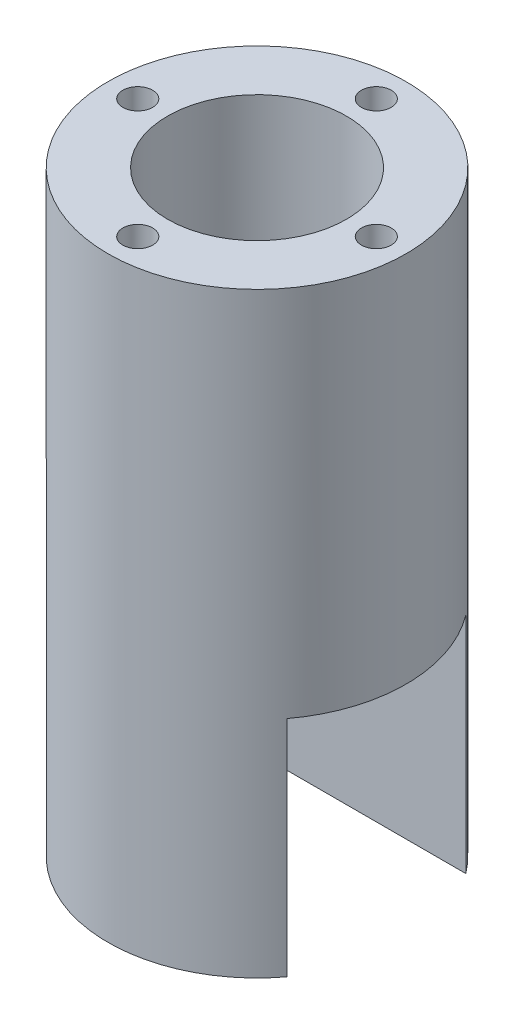
from build123d import *

# Parameters (mm, degrees)
SKETCH_1_R               = 10
SKETCH_1_R_2             = 6
EXTRUDE_1_DEPTH          = 40
SKETCH_2_R               = 1
CUT_EXTRUDE_1_DEPTH      = 2
CUT_EXTRUDE_2_DEPTH      = 43.426406871
CUT_EXTRUDE_2_DEPTH_BACK = 43.426406871
SKETCH_3_W               = 12
SKETCH_3_H               = 15


with BuildPart() as part:
    # 草图1 → 凸台-拉伸1 (new body)
    with BuildSketch(Plane(origin=(0, 0, 0), x_dir=(1, 0, 0), z_dir=(0, 1, 0))):
        with Locations(Location((0, 0, 0), (0, 0, 270))):
            Circle(SKETCH_1_R)
        with Locations(Location((0, 0, 0), (0, 0, 270))):
            Circle(SKETCH_1_R_2, mode=Mode.SUBTRACT)
    extrude(amount=EXTRUDE_1_DEPTH)

    # 草图2 → 切除-拉伸1 (cut)
    with BuildSketch(Plane(origin=(0, 40, 0), x_dir=(1, 0, 0), z_dir=(0, 1, 0))):
        with Locations(Location((-8, 0, 0), (0, 0, 270))):
            Circle(SKETCH_2_R)
        with Locations(Location((8, 0, 0), (0, 0, 90))):
            Circle(SKETCH_2_R)
        with Locations(Location((0, 8, 0), (0, 0, 270))):
            Circle(SKETCH_2_R)
        with Locations(Location((0, -8, 0), (0, 0, 90))):
            Circle(SKETCH_2_R)
    extrude(amount=-CUT_EXTRUDE_1_DEPTH, mode=Mode.SUBTRACT)

    # 草图3 → 切除-拉伸2 (cut, two sides: drawn at the far end of the back side and taken through both)
    with BuildSketch(Plane(origin=(0, 0, 0), x_dir=(0, 0, -1), z_dir=(1, 0, 0)).offset(-CUT_EXTRUDE_2_DEPTH_BACK)):
        with Locations((0, 7.5)):
            Rectangle(SKETCH_3_W, SKETCH_3_H)
    extrude(amount=CUT_EXTRUDE_2_DEPTH + CUT_EXTRUDE_2_DEPTH_BACK, mode=Mode.SUBTRACT)


solid = part.part
